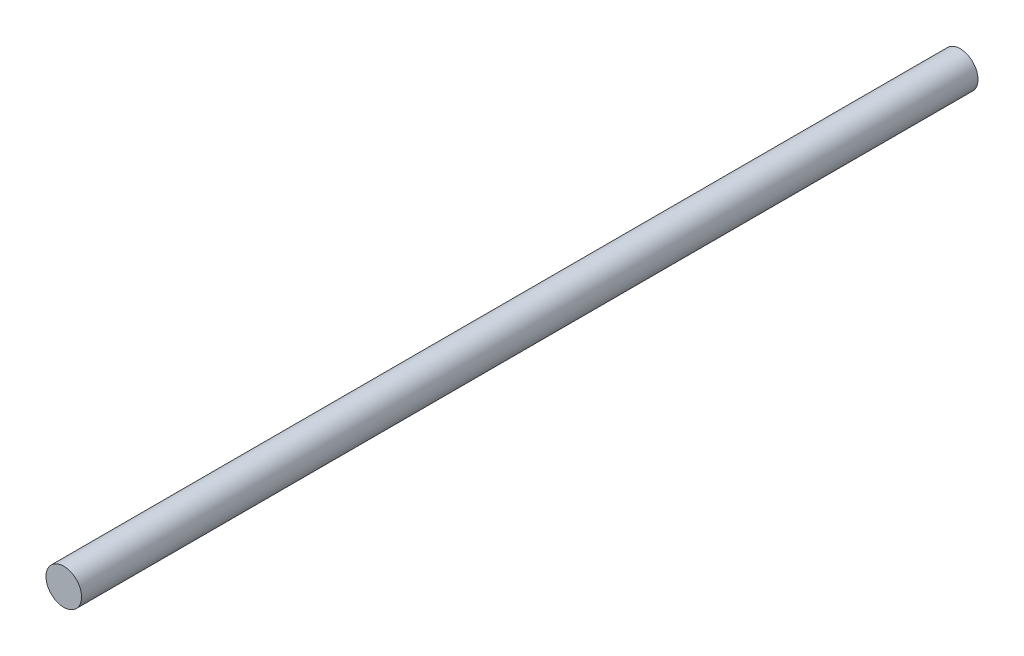
from build123d import *

# Parameters (mm, degrees)
SKETCH_1_R      = 3
EXTRUDE_1_DEPTH = 151


with BuildPart() as part:
    # 草图1 → 凸台-拉伸1 (new body)
    with BuildSketch(Plane.XY):
        Circle(SKETCH_1_R)
    extrude(amount=EXTRUDE_1_DEPTH)


solid = part.part
